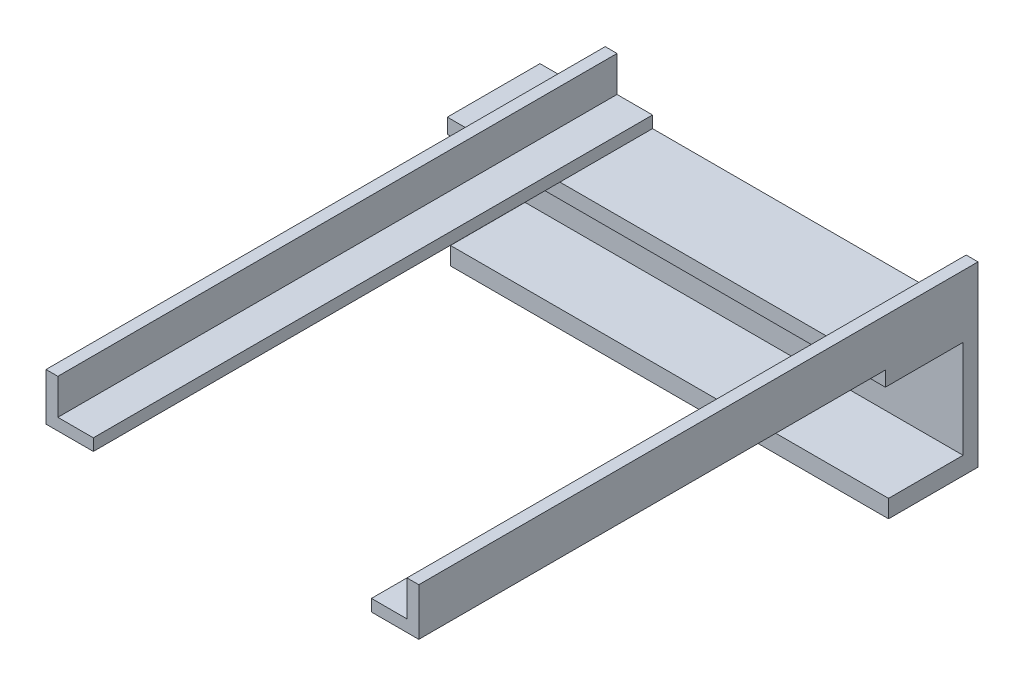
from build123d import *

# Parameters (mm, degrees)
CROQUIS1_W              = 235
CROQUIS1_H              = 70
SALIENTE_EXTRUIR1_DEPTH = 8
CROQUIS2_W              = 235
CROQUIS2_H              = 49.698460378
SALIENTE_EXTRUIR2_DEPTH = 8
SALIENTE_EXTRUIR3_DEPTH = 300
CROQUIS4_W              = 235
CROQUIS4_H              = 9.525
SALIENTE_EXTRUIR4_DEPTH = 40


with BuildPart() as part:
    # Croquis1 → Saliente-Extruir1 (new body)
    with BuildSketch(Plane.XY):
        Rectangle(CROQUIS1_W, CROQUIS1_H)
    extrude(amount=SALIENTE_EXTRUIR1_DEPTH)

    # Croquis2 → Saliente-Extruir2 (add)
    with BuildSketch(Plane(origin=(0, 35, 0), x_dir=(1, 0, 0), z_dir=(0, 1, 0))):
        with Locations((0, -24.849230189)):
            Rectangle(CROQUIS2_W, CROQUIS2_H)
    extrude(amount=-SALIENTE_EXTRUIR2_DEPTH)

    # Croquis3 → Saliente-Extruir3 (add)
    with BuildSketch(Plane(origin=(0, 0, 0), x_dir=(-1, 0, 0), z_dir=(0, 0, -1))):
        Polygon((-117.5, 35), (-117.5, 60.4), (-111.15, 60.4), (-111.15, 41.35), (-92.1, 41.35), (-92.1, 35), align=None)
        Polygon((57.1, 35), (82.5, 35), (82.5, 60.4), (76.15, 60.4), (76.15, 41.35), (57.1, 41.35), align=None)
    extrude(amount=-SALIENTE_EXTRUIR3_DEPTH)

    # Croquis4 → Saliente-Extruir4 (add)
    with BuildSketch(Plane.XY.offset(8)):
        with Locations((0, -30.2375)):
            Rectangle(CROQUIS4_W, CROQUIS4_H)
    extrude(amount=SALIENTE_EXTRUIR4_DEPTH)


solid = part.part
